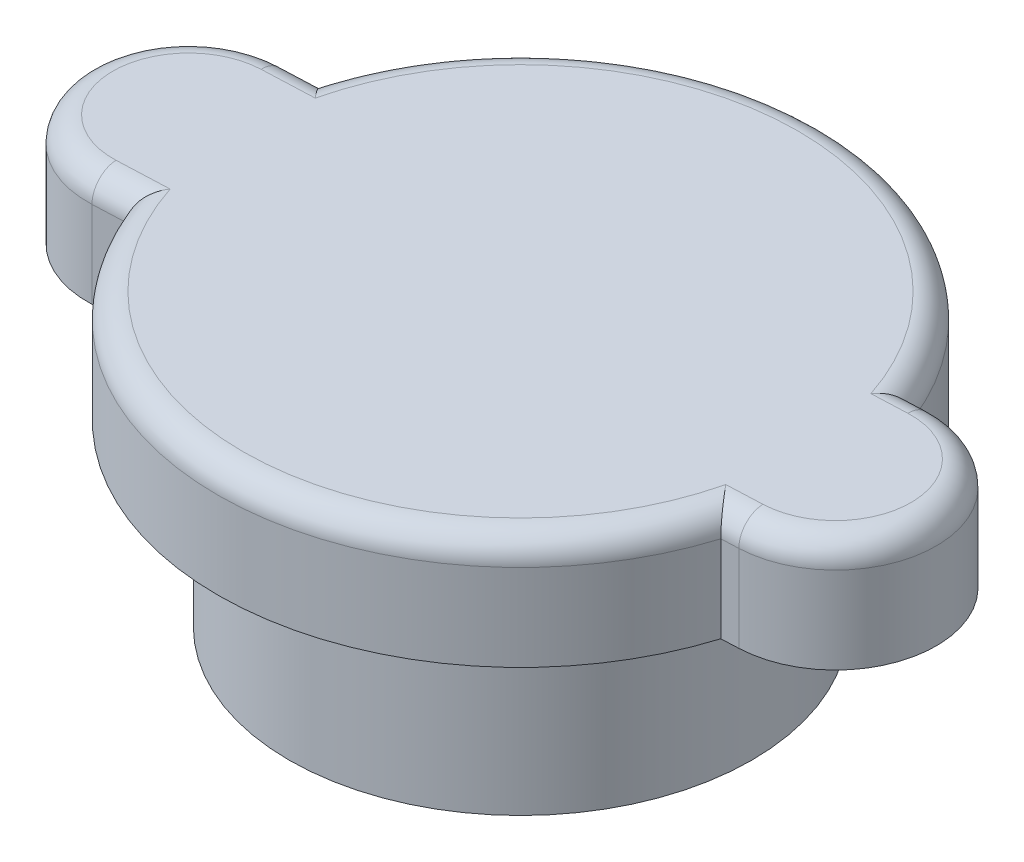
from build123d import *

# Parameters (mm, degrees)
SKETCH11_R = 18.415
NECK_DEPTH = 14.224
SKETCH12_R = 24.098503073
LID_DEPTH  = 8.89
FILLET3_R  = 2


with BuildPart() as part:
    # Sketch11 → neck (new body)
    with BuildSketch(Plane(origin=(0, 0, 0), x_dir=(1, 0, 0), z_dir=(0, 1, 0))):
        with Locations(Location((0, 0, 0), (0, 0, 270))):
            Circle(SKETCH11_R)
    extrude(amount=NECK_DEPTH)

    # Sketch12 → lid (add)
    with BuildSketch(Plane(origin=(0, 14.224, 0), x_dir=(1, 0, 0), z_dir=(0, 1, 0))):
        Circle(SKETCH12_R)
        with BuildLine():
            Line((-25.707660556, 6.978419473), (23.749239481, 9.0074205))
            ThreePointArc((23.749239481, 9.0074205), (32.097843424, 1.316834602), (24.407257526, -7.031769341))
            Line((24.407257526, -7.031769341), (-25.049642512, -9.060770368))
            ThreePointArc((-25.049642512, -9.060770368), (-33.398246454, -1.37018447), (-25.707660556, 6.978419473))
        make_face()
    extrude(amount=LID_DEPTH)

    # Fillet3
    fillet3_edges = [part.edges().sort_by_distance(p)[0] for p in [
        (23.719874862, 23.114, 7.059969655),
        (32.097843424, 23.114, -1.316834602),
        (0.98782558, 23.114, 24.078248504),
        (23.061856817, 23.114, -8.979220186),
        (-23.712058333, 23.114, 9.00589512),
        (-0.98782558, 23.114, -24.078248504),
        (-33.398246454, 23.114, 1.37018447),
        (-24.370076377, 23.114, -7.033294721),
    ]]
    fillet(fillet3_edges, radius=FILLET3_R)


solid = part.part
